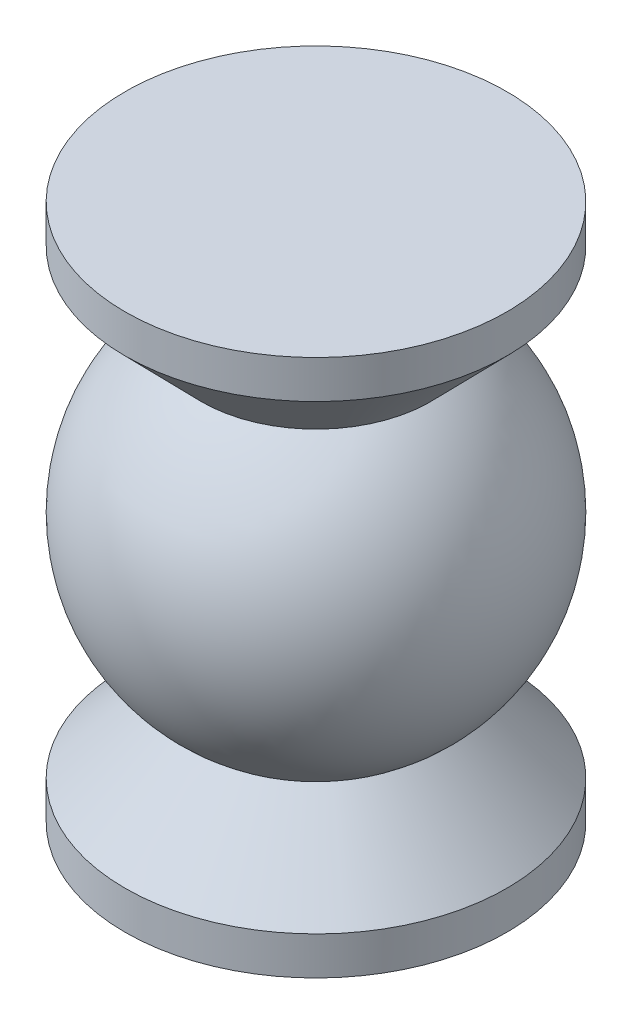
from build123d import *


with BuildPart() as part:
    # 草图1 → 旋转1 (revolve)
    with BuildSketch(Plane.XY, mode=Mode.PRIVATE) as revolve_1_sk:
        with BuildLine():
            Line((0, 19.616874865), (-25, 19.616874865))
            Line((-25, 19.616874865), (-25, 14.616874865))
            Line((-25, 14.616874865), (-15, 4.416874865))
            ThreePointArc((-15, 4.416874865), (-25, -15.583125135), (-15, -35.583125135))
            Line((-15, -35.583125135), (-25, -45.783125135))
            Line((-25, -45.783125135), (-25, -50.783125135))
            Line((-25, -50.783125135), (0, -50.783125135))
            Line((0, -50.783125135), (0, 19.616874865))
        make_face()
    revolve(revolve_1_sk.sketch.rotate(Axis((0, 19.616874865, 0), (0, -1, 0)), 270), axis=Axis((0, 19.616874865, 0), (0, -1, 0)))


solid = part.part
